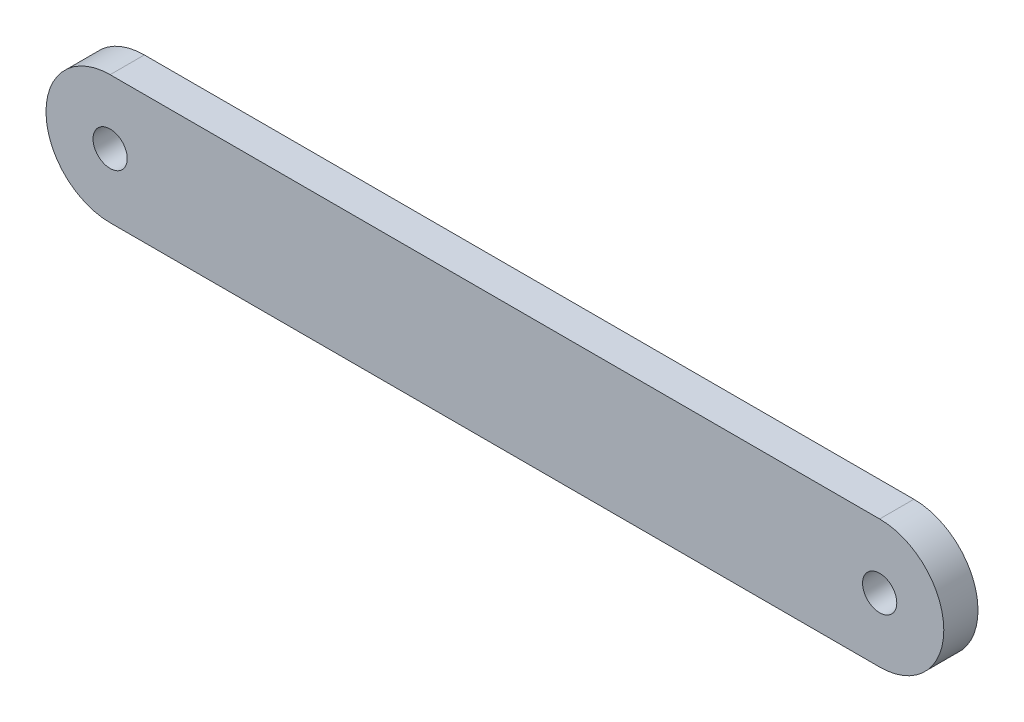
from build123d import *

# Parameters (mm, degrees)
SKETCH1_R           = 2
BOSS_EXTRUDE1_DEPTH = 4


with BuildPart() as part:
    # Sketch1 → Boss-Extrude1 (new body)
    with BuildSketch(Plane.XY):
        with BuildLine():
            Line((0, 7.5), (90, 7.5))
            ThreePointArc((90, 7.5), (97.5, 0), (90, -7.5))
            Line((90, -7.5), (0, -7.5))
            ThreePointArc((0, -7.5), (-7.5, 0), (0, 7.5))
        make_face()
        Circle(SKETCH1_R, mode=Mode.SUBTRACT)
        with Locations((90, 0)):
            Circle(SKETCH1_R, mode=Mode.SUBTRACT)
    extrude(amount=BOSS_EXTRUDE1_DEPTH)


solid = part.part
